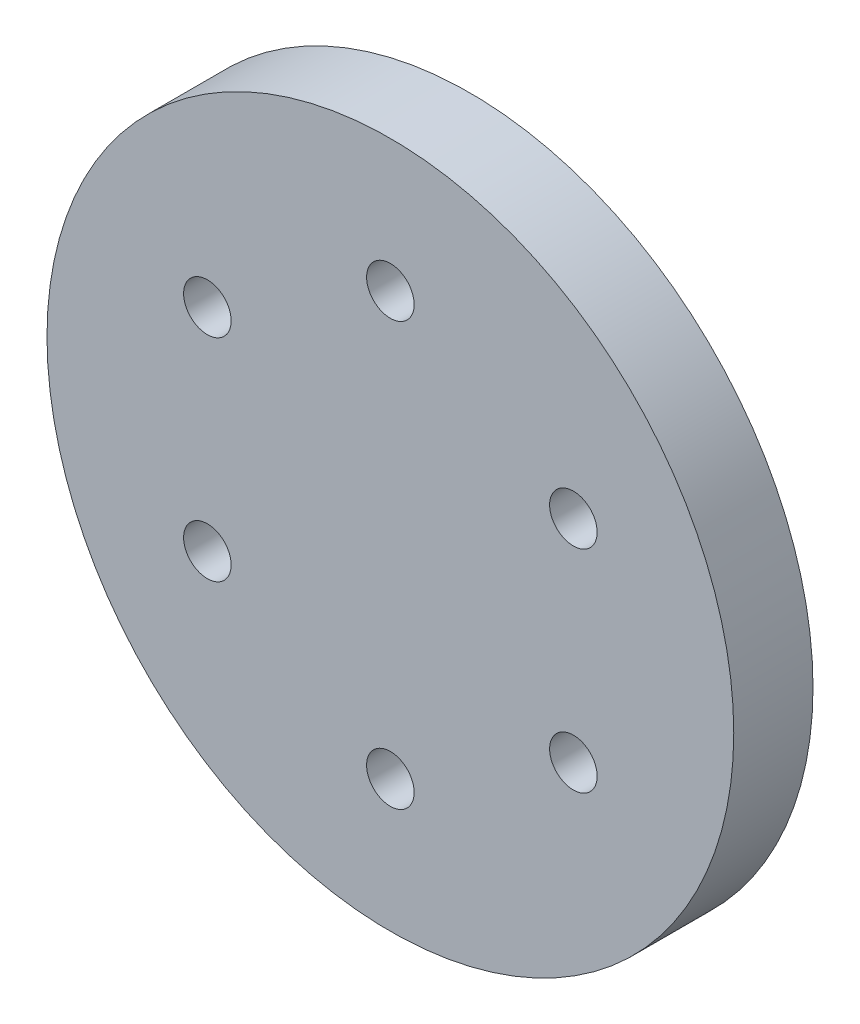
from build123d import *

# Parameters (mm, degrees)
SKETCH_1_R               = 13
EXTRUDE_1_DEPTH          = 3
SKETCH_2_R               = 0.9
CUT_EXTRUDE_1_DEPTH      = 19.62793601
SKETCH_2_3_R             = 1.5
CUT_EXTRUDE_2_DEPTH      = 1.5
PATTERN_CIRCULAR_1_COUNT = 6


with BuildPart() as part:
    # 草图1 → 凸台-拉伸1 (new body)
    with BuildSketch(Plane.XY):
        Circle(SKETCH_1_R)
    extrude(amount=EXTRUDE_1_DEPTH)

    # 草图2 → 切除-拉伸1 (cut, through all)
    with BuildSketch(Plane(origin=(0, 0, 0), x_dir=(-1, 0, 0), z_dir=(0, 0, -1))):
        with Locations((0, 8)):
            Circle(SKETCH_2_R)
    cut_extrude_1 = extrude(amount=-CUT_EXTRUDE_1_DEPTH, mode=Mode.SUBTRACT)

    # 草图2<3> → 切除-拉伸2 (cut)
    with BuildSketch(Plane(origin=(0, 0, 0), x_dir=(-1, 0, 0), z_dir=(0, 0, -1))):
        with Locations((0, 8)):
            Circle(SKETCH_2_3_R)
    cut_extrude_2 = extrude(amount=-CUT_EXTRUDE_2_DEPTH, mode=Mode.SUBTRACT)

    # 阵列(圆周)1: 切除-拉伸1, 切除-拉伸2 ×6 about axis
    pattern_circular_1_axis = Axis((0, 0, 3), (0, 0, -1))
    add([cut_extrude_1.rotate(pattern_circular_1_axis, i * 360 / PATTERN_CIRCULAR_1_COUNT) for i in range(1, PATTERN_CIRCULAR_1_COUNT)], mode=Mode.SUBTRACT)
    add([cut_extrude_2.rotate(pattern_circular_1_axis, i * 360 / PATTERN_CIRCULAR_1_COUNT) for i in range(1, PATTERN_CIRCULAR_1_COUNT)], mode=Mode.SUBTRACT)


solid = part.part
